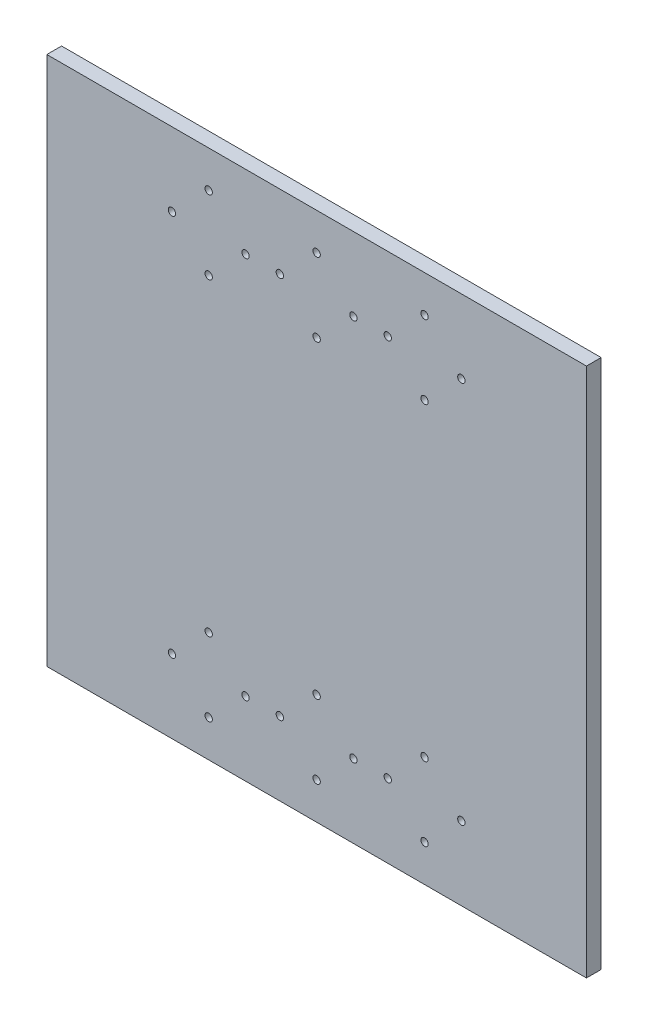
from build123d import *

# Parameters (mm, degrees)
CROQUIS1_W              = 110
CROQUIS1_H              = 108.04
SALIENTE_EXTRUIR1_DEPTH = 3
CORTAR_EXTRUIR1_REACH   = 79.15
CROQUIS2_R              = 0.75


with BuildPart() as part:
    # Croquis1 → Saliente-Extruir1 (new body)
    with BuildSketch(Plane.XY):
        Rectangle(CROQUIS1_W, CROQUIS1_H)
    extrude(amount=SALIENTE_EXTRUIR1_DEPTH)

    # Croquis2 → Cortar-Extruir1 (cut, up to next)
    with BuildSketch(Plane.XY.offset(3), mode=Mode.PRIVATE) as cortar_extruir1_sk1:
        with Locations((7.5, -39.02)):
            Circle(CROQUIS2_R)
    cortar_extruir1_tool1 = extrude(cortar_extruir1_sk1.sketch, amount=-CORTAR_EXTRUIR1_REACH, mode=Mode.PRIVATE) & part.part
    # Croquis2 → Cortar-Extruir1 (cut, up to next)
    with BuildSketch(Plane.XY.offset(3), mode=Mode.PRIVATE) as cortar_extruir1_sk2:
        with Locations((-7.5, -39.02)):
            Circle(CROQUIS2_R)
    cortar_extruir1_tool2 = extrude(cortar_extruir1_sk2.sketch, amount=-CORTAR_EXTRUIR1_REACH, mode=Mode.PRIVATE) & part.part
    # Croquis2 → Cortar-Extruir1 (cut, up to next)
    with BuildSketch(Plane.XY.offset(3), mode=Mode.PRIVATE) as cortar_extruir1_sk3:
        with Locations((0, -46.52)):
            Circle(CROQUIS2_R)
    cortar_extruir1_tool3 = extrude(cortar_extruir1_sk3.sketch, amount=-CORTAR_EXTRUIR1_REACH, mode=Mode.PRIVATE) & part.part
    # Croquis2 → Cortar-Extruir1 (cut, up to next)
    with BuildSketch(Plane.XY.offset(3), mode=Mode.PRIVATE) as cortar_extruir1_sk4:
        with Locations((0, -31.52)):
            Circle(CROQUIS2_R)
    cortar_extruir1_tool4 = extrude(cortar_extruir1_sk4.sketch, amount=-CORTAR_EXTRUIR1_REACH, mode=Mode.PRIVATE) & part.part
    # Croquis2 → Cortar-Extruir1 (cut, up to next)
    with BuildSketch(Plane.XY.offset(3), mode=Mode.PRIVATE) as cortar_extruir1_sk5:
        with Locations((14.5, -39.02)):
            Circle(CROQUIS2_R)
    cortar_extruir1_tool5 = extrude(cortar_extruir1_sk5.sketch, amount=-CORTAR_EXTRUIR1_REACH, mode=Mode.PRIVATE) & part.part
    # Croquis2 → Cortar-Extruir1 (cut, up to next)
    with BuildSketch(Plane.XY.offset(3), mode=Mode.PRIVATE) as cortar_extruir1_sk6:
        with Locations((22, -31.52)):
            Circle(CROQUIS2_R)
    cortar_extruir1_tool6 = extrude(cortar_extruir1_sk6.sketch, amount=-CORTAR_EXTRUIR1_REACH, mode=Mode.PRIVATE) & part.part
    # Croquis2 → Cortar-Extruir1 (cut, up to next)
    with BuildSketch(Plane.XY.offset(3), mode=Mode.PRIVATE) as cortar_extruir1_sk7:
        with Locations((22, -46.52)):
            Circle(CROQUIS2_R)
    cortar_extruir1_tool7 = extrude(cortar_extruir1_sk7.sketch, amount=-CORTAR_EXTRUIR1_REACH, mode=Mode.PRIVATE) & part.part
    # Croquis2 → Cortar-Extruir1 (cut, up to next)
    with BuildSketch(Plane.XY.offset(3), mode=Mode.PRIVATE) as cortar_extruir1_sk8:
        with Locations((29.5, -39.02)):
            Circle(CROQUIS2_R)
    cortar_extruir1_tool8 = extrude(cortar_extruir1_sk8.sketch, amount=-CORTAR_EXTRUIR1_REACH, mode=Mode.PRIVATE) & part.part
    # Croquis2 → Cortar-Extruir1 (cut, up to next)
    with BuildSketch(Plane.XY.offset(3), mode=Mode.PRIVATE) as cortar_extruir1_sk9:
        with Locations((-22, -31.52)):
            Circle(CROQUIS2_R)
    cortar_extruir1_tool9 = extrude(cortar_extruir1_sk9.sketch, amount=-CORTAR_EXTRUIR1_REACH, mode=Mode.PRIVATE) & part.part
    # Croquis2 → Cortar-Extruir1 (cut, up to next)
    with BuildSketch(Plane.XY.offset(3), mode=Mode.PRIVATE) as cortar_extruir1_sk10:
        with Locations((-29.5, -39.02)):
            Circle(CROQUIS2_R)
    cortar_extruir1_tool10 = extrude(cortar_extruir1_sk10.sketch, amount=-CORTAR_EXTRUIR1_REACH, mode=Mode.PRIVATE) & part.part
    # Croquis2 → Cortar-Extruir1 (cut, up to next)
    with BuildSketch(Plane.XY.offset(3), mode=Mode.PRIVATE) as cortar_extruir1_sk11:
        with Locations((-22, -46.52)):
            Circle(CROQUIS2_R)
    cortar_extruir1_tool11 = extrude(cortar_extruir1_sk11.sketch, amount=-CORTAR_EXTRUIR1_REACH, mode=Mode.PRIVATE) & part.part
    # Croquis2 → Cortar-Extruir1 (cut, up to next)
    with BuildSketch(Plane.XY.offset(3), mode=Mode.PRIVATE) as cortar_extruir1_sk12:
        with Locations((-14.5, -39.02)):
            Circle(CROQUIS2_R)
    cortar_extruir1_tool12 = extrude(cortar_extruir1_sk12.sketch, amount=-CORTAR_EXTRUIR1_REACH, mode=Mode.PRIVATE) & part.part
    # Croquis2 → Cortar-Extruir1 (cut, up to next)
    with BuildSketch(Plane.XY.offset(3), mode=Mode.PRIVATE) as cortar_extruir1_sk13:
        with Locations((29.5, 39.02)):
            Circle(CROQUIS2_R)
    cortar_extruir1_tool13 = extrude(cortar_extruir1_sk13.sketch, amount=-CORTAR_EXTRUIR1_REACH, mode=Mode.PRIVATE) & part.part
    # Croquis2 → Cortar-Extruir1 (cut, up to next)
    with BuildSketch(Plane.XY.offset(3), mode=Mode.PRIVATE) as cortar_extruir1_sk14:
        with Locations((22, 31.52)):
            Circle(CROQUIS2_R)
    cortar_extruir1_tool14 = extrude(cortar_extruir1_sk14.sketch, amount=-CORTAR_EXTRUIR1_REACH, mode=Mode.PRIVATE) & part.part
    # Croquis2 → Cortar-Extruir1 (cut, up to next)
    with BuildSketch(Plane.XY.offset(3), mode=Mode.PRIVATE) as cortar_extruir1_sk15:
        with Locations((22, 46.52)):
            Circle(CROQUIS2_R)
    cortar_extruir1_tool15 = extrude(cortar_extruir1_sk15.sketch, amount=-CORTAR_EXTRUIR1_REACH, mode=Mode.PRIVATE) & part.part
    # Croquis2 → Cortar-Extruir1 (cut, up to next)
    with BuildSketch(Plane.XY.offset(3), mode=Mode.PRIVATE) as cortar_extruir1_sk16:
        with Locations((14.5, 39.02)):
            Circle(CROQUIS2_R)
    cortar_extruir1_tool16 = extrude(cortar_extruir1_sk16.sketch, amount=-CORTAR_EXTRUIR1_REACH, mode=Mode.PRIVATE) & part.part
    # Croquis2 → Cortar-Extruir1 (cut, up to next)
    with BuildSketch(Plane.XY.offset(3), mode=Mode.PRIVATE) as cortar_extruir1_sk17:
        with Locations((7.5, 39.02)):
            Circle(CROQUIS2_R)
    cortar_extruir1_tool17 = extrude(cortar_extruir1_sk17.sketch, amount=-CORTAR_EXTRUIR1_REACH, mode=Mode.PRIVATE) & part.part
    # Croquis2 → Cortar-Extruir1 (cut, up to next)
    with BuildSketch(Plane.XY.offset(3), mode=Mode.PRIVATE) as cortar_extruir1_sk18:
        with Locations((0, 46.52)):
            Circle(CROQUIS2_R)
    cortar_extruir1_tool18 = extrude(cortar_extruir1_sk18.sketch, amount=-CORTAR_EXTRUIR1_REACH, mode=Mode.PRIVATE) & part.part
    # Croquis2 → Cortar-Extruir1 (cut, up to next)
    with BuildSketch(Plane.XY.offset(3), mode=Mode.PRIVATE) as cortar_extruir1_sk19:
        with Locations((0, 31.52)):
            Circle(CROQUIS2_R)
    cortar_extruir1_tool19 = extrude(cortar_extruir1_sk19.sketch, amount=-CORTAR_EXTRUIR1_REACH, mode=Mode.PRIVATE) & part.part
    # Croquis2 → Cortar-Extruir1 (cut, up to next)
    with BuildSketch(Plane.XY.offset(3), mode=Mode.PRIVATE) as cortar_extruir1_sk20:
        with Locations((-7.5, 39.02)):
            Circle(CROQUIS2_R)
    cortar_extruir1_tool20 = extrude(cortar_extruir1_sk20.sketch, amount=-CORTAR_EXTRUIR1_REACH, mode=Mode.PRIVATE) & part.part
    # Croquis2 → Cortar-Extruir1 (cut, up to next)
    with BuildSketch(Plane.XY.offset(3), mode=Mode.PRIVATE) as cortar_extruir1_sk21:
        with Locations((-14.5, 39.02)):
            Circle(CROQUIS2_R)
    cortar_extruir1_tool21 = extrude(cortar_extruir1_sk21.sketch, amount=-CORTAR_EXTRUIR1_REACH, mode=Mode.PRIVATE) & part.part
    # Croquis2 → Cortar-Extruir1 (cut, up to next)
    with BuildSketch(Plane.XY.offset(3), mode=Mode.PRIVATE) as cortar_extruir1_sk22:
        with Locations((-22, 46.52)):
            Circle(CROQUIS2_R)
    cortar_extruir1_tool22 = extrude(cortar_extruir1_sk22.sketch, amount=-CORTAR_EXTRUIR1_REACH, mode=Mode.PRIVATE) & part.part
    # Croquis2 → Cortar-Extruir1 (cut, up to next)
    with BuildSketch(Plane.XY.offset(3), mode=Mode.PRIVATE) as cortar_extruir1_sk23:
        with Locations((-22, 31.52)):
            Circle(CROQUIS2_R)
    cortar_extruir1_tool23 = extrude(cortar_extruir1_sk23.sketch, amount=-CORTAR_EXTRUIR1_REACH, mode=Mode.PRIVATE) & part.part
    # Croquis2 → Cortar-Extruir1 (cut, up to next)
    with BuildSketch(Plane.XY.offset(3), mode=Mode.PRIVATE) as cortar_extruir1_sk24:
        with Locations((-29.5, 39.02)):
            Circle(CROQUIS2_R)
    cortar_extruir1_tool24 = extrude(cortar_extruir1_sk24.sketch, amount=-CORTAR_EXTRUIR1_REACH, mode=Mode.PRIVATE) & part.part
    add(cortar_extruir1_tool1.solids().sort_by_distance((7.5, -39.02, 3))[0], mode=Mode.SUBTRACT)
    add(cortar_extruir1_tool2.solids().sort_by_distance((-7.5, -39.02, 3))[0], mode=Mode.SUBTRACT)
    add(cortar_extruir1_tool3.solids().sort_by_distance((0, -46.52, 3))[0], mode=Mode.SUBTRACT)
    add(cortar_extruir1_tool4.solids().sort_by_distance((0, -31.52, 3))[0], mode=Mode.SUBTRACT)
    add(cortar_extruir1_tool5.solids().sort_by_distance((14.5, -39.02, 3))[0], mode=Mode.SUBTRACT)
    add(cortar_extruir1_tool6.solids().sort_by_distance((22, -31.52, 3))[0], mode=Mode.SUBTRACT)
    add(cortar_extruir1_tool7.solids().sort_by_distance((22, -46.52, 3))[0], mode=Mode.SUBTRACT)
    add(cortar_extruir1_tool8.solids().sort_by_distance((29.5, -39.02, 3))[0], mode=Mode.SUBTRACT)
    add(cortar_extruir1_tool9.solids().sort_by_distance((-22, -31.52, 3))[0], mode=Mode.SUBTRACT)
    add(cortar_extruir1_tool10.solids().sort_by_distance((-29.5, -39.02, 3))[0], mode=Mode.SUBTRACT)
    add(cortar_extruir1_tool11.solids().sort_by_distance((-22, -46.52, 3))[0], mode=Mode.SUBTRACT)
    add(cortar_extruir1_tool12.solids().sort_by_distance((-14.5, -39.02, 3))[0], mode=Mode.SUBTRACT)
    add(cortar_extruir1_tool13.solids().sort_by_distance((29.5, 39.02, 3))[0], mode=Mode.SUBTRACT)
    add(cortar_extruir1_tool14.solids().sort_by_distance((22, 31.52, 3))[0], mode=Mode.SUBTRACT)
    add(cortar_extruir1_tool15.solids().sort_by_distance((22, 46.52, 3))[0], mode=Mode.SUBTRACT)
    add(cortar_extruir1_tool16.solids().sort_by_distance((14.5, 39.02, 3))[0], mode=Mode.SUBTRACT)
    add(cortar_extruir1_tool17.solids().sort_by_distance((7.5, 39.02, 3))[0], mode=Mode.SUBTRACT)
    add(cortar_extruir1_tool18.solids().sort_by_distance((0, 46.52, 3))[0], mode=Mode.SUBTRACT)
    add(cortar_extruir1_tool19.solids().sort_by_distance((0, 31.52, 3))[0], mode=Mode.SUBTRACT)
    add(cortar_extruir1_tool20.solids().sort_by_distance((-7.5, 39.02, 3))[0], mode=Mode.SUBTRACT)
    add(cortar_extruir1_tool21.solids().sort_by_distance((-14.5, 39.02, 3))[0], mode=Mode.SUBTRACT)
    add(cortar_extruir1_tool22.solids().sort_by_distance((-22, 46.52, 3))[0], mode=Mode.SUBTRACT)
    add(cortar_extruir1_tool23.solids().sort_by_distance((-22, 31.52, 3))[0], mode=Mode.SUBTRACT)
    add(cortar_extruir1_tool24.solids().sort_by_distance((-29.5, 39.02, 3))[0], mode=Mode.SUBTRACT)


solid = part.part
